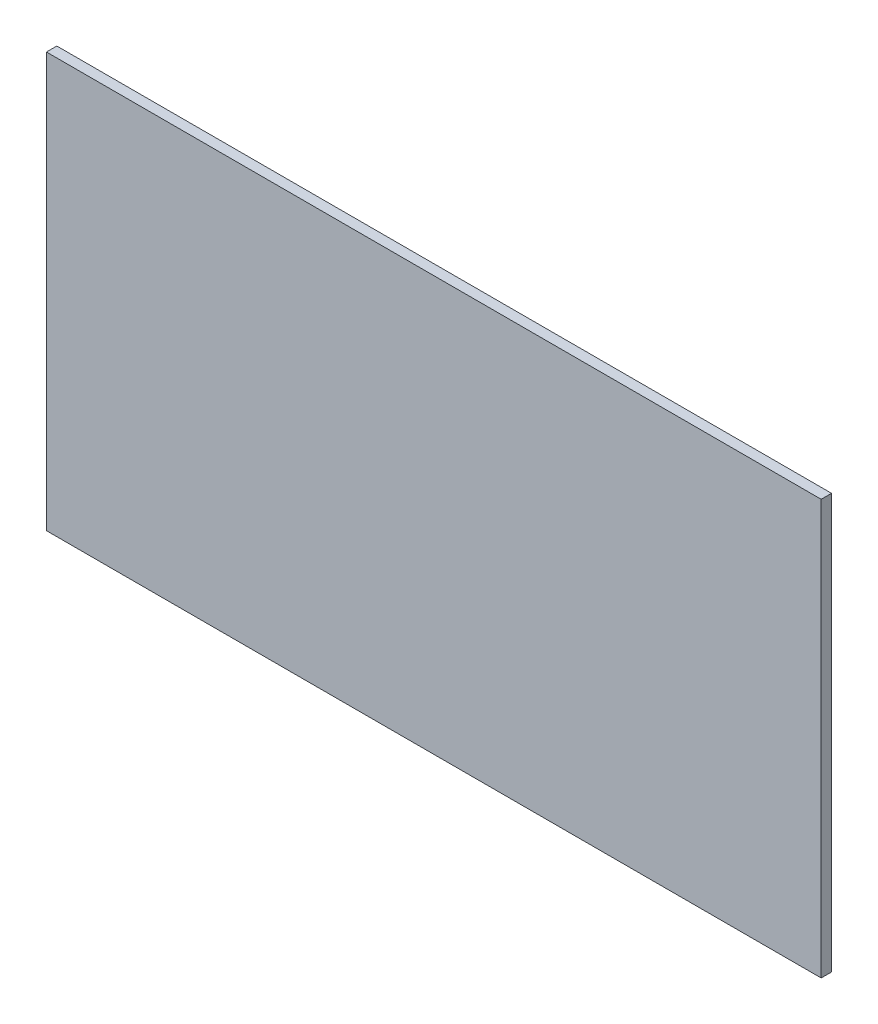
from build123d import *

# Parameters (mm, degrees)
SKETCH_1_W      = 186.873025202
SKETCH_1_H      = 2.5
EXTRUDE_1_DEPTH = 100


with BuildPart() as part:
    # Эскиз1 → Вытянуть1 (new body)
    with BuildSketch(Plane(origin=(0, 0, 0), x_dir=(1, 0, 0), z_dir=(0, 1, 0))):
        with Locations((93.436512601, -1.25)):
            Rectangle(SKETCH_1_W, SKETCH_1_H)
    extrude(amount=EXTRUDE_1_DEPTH)


solid = part.part
